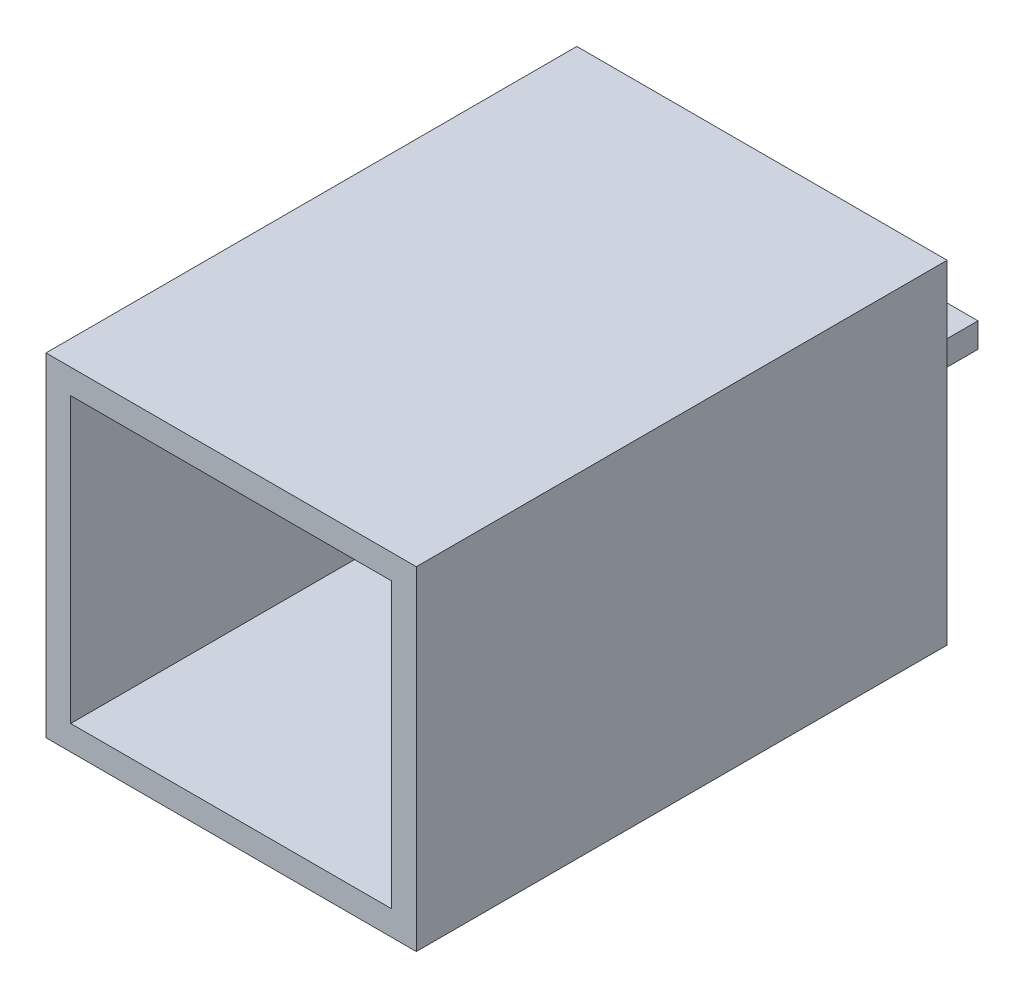
from build123d import *

# Parameters (mm, degrees)
SKETCH1_W           = 30
SKETCH1_H           = 27
SKETCH1_W_2         = 26
SKETCH1_H_2         = 23
BOSS_EXTRUDE1_DEPTH = 43
SKETCH3_W           = 30
SKETCH3_H           = 15
BOSS_EXTRUDE2_DEPTH = 2
SKETCH5_W           = 15
SKETCH5_H           = 2
SKETCH5_W_2         = 5
BOSS_EXTRUDE3_DEPTH = 10
BOSS_EXTRUDE4_DEPTH = 5
SKETCH7_W           = 5
SKETCH7_H           = 2
CUT_EXTRUDE1_DEPTH  = 5
FILLET3_R           = 0.5


with BuildPart() as part:
    # Sketch1 → Boss-Extrude1 (new body)
    with BuildSketch(Plane.XY):
        Rectangle(SKETCH1_W, SKETCH1_H)
        Rectangle(SKETCH1_W_2, SKETCH1_H_2, mode=Mode.SUBTRACT)
    extrude(amount=BOSS_EXTRUDE1_DEPTH)

    # Sketch3 → Boss-Extrude2 (add)
    with BuildSketch(Plane(origin=(0, 0, 0), x_dir=(-1, 0, 0), z_dir=(0, 0, -1))):
        with Locations((0, 6)):
            Rectangle(SKETCH3_W, SKETCH3_H)
    extrude(amount=-BOSS_EXTRUDE2_DEPTH)

    # Sketch5 → Boss-Extrude3 (add)
    with BuildSketch(Plane(origin=(0, 0, 0), x_dir=(-1, 0, 0), z_dir=(0, 0, -1))):
        with Locations((0, -0.5)):
            Rectangle(SKETCH5_W, SKETCH5_H)
        with Locations((0, -12.5)):
            Rectangle(SKETCH5_W_2, SKETCH5_H)
    extrude(amount=BOSS_EXTRUDE3_DEPTH)

    # Sketch6 → Boss-Extrude4 (add)
    with BuildSketch(Plane.ZY.offset(2.5)):
        Polygon((-5, -13.5), (-3, -15.5), (-3, -13.5), align=None)
    extrude(amount=-BOSS_EXTRUDE4_DEPTH)

    # Sketch7 → Cut-Extrude1 (cut)
    with BuildSketch(Plane(origin=(0, 0, -10), x_dir=(-1, 0, 0), z_dir=(0, 0, -1))):
        with Locations((0, -12.5)):
            Rectangle(SKETCH7_W, SKETCH7_H)
    extrude(amount=-CUT_EXTRUDE1_DEPTH, mode=Mode.SUBTRACT)

    # Fillet3
    fillet3_edges = [part.edges().sort_by_distance(p)[0] for p in [
        (0, -13.5, -5),
        (0, -15.5, -3),
        (0, -11.5, -5),
    ]]
    fillet(fillet3_edges, radius=FILLET3_R)


solid = part.part
